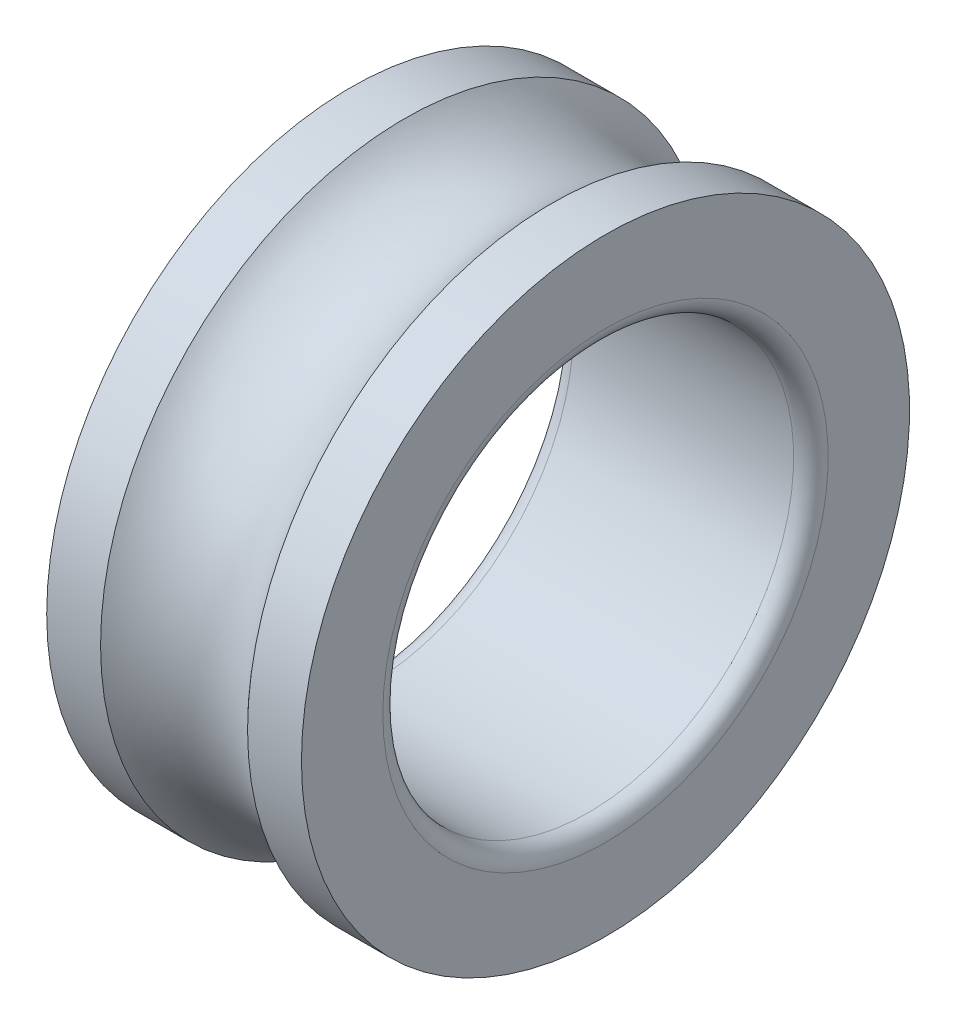
from build123d import *

# Parameters (mm, degrees)
FILLET1_R    = 2.1
SCALE1_SCALE = 0.1


with BuildPart() as part:
    # Sketch1 → Revolve1 (revolve)
    with BuildSketch(Plane.XY, mode=Mode.PRIVATE) as revolve1_sk:
        with BuildLine():
            Line((8.94427191, 37), (15.5, 37))
            Line((15.5, 37), (15.5, 25))
            Line((15.5, 25), (-15.5, 25))
            Line((-15.5, 25), (-15.5, 37))
            Line((-15.5, 37), (-8.94427191, 37))
            ThreePointArc((-8.94427191, 37), (0, 33), (8.94427191, 37))
        make_face()
    revolve(revolve1_sk.sketch.rotate(Axis((-11.13592233, 0, 0), (1, 0, 0)), 90), axis=Axis((-11.13592233, 0, 0), (1, 0, 0)))

    # Fillet1
    fillet1_edges = [part.edges().sort_by_distance(p)[0] for p in [
        (-15.5, 0, -25),
        (15.5, 0, -25),
    ]]
    fillet(fillet1_edges, radius=FILLET1_R)


with BuildPart() as part_1:
    # Scale1: scaled about (0, 0, 0)
    add(part.part.scale(SCALE1_SCALE))


solid = part_1.part
